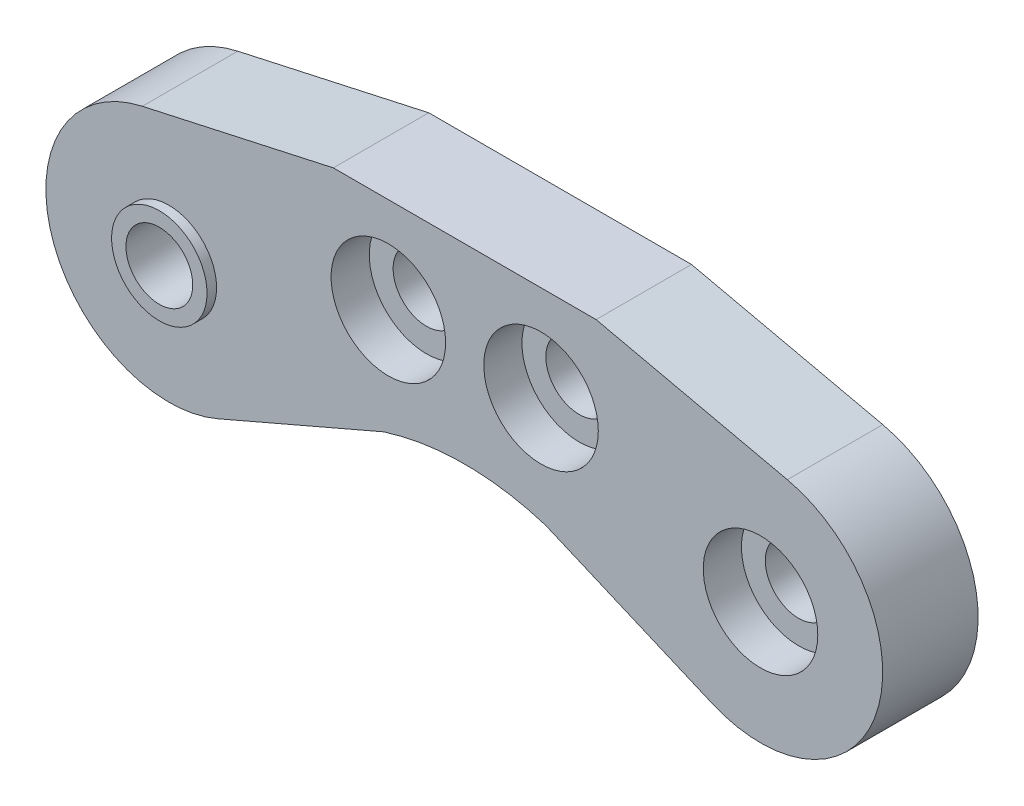
from build123d import *

# Parameters (mm, degrees)
BOSS_EXTRUDE1_DEPTH     = 5
CUT_EXTRUDE1_DEPTH      = 53.75142939
CUT_EXTRUDE1_DEPTH_BACK = 53.75142939
SKETCH2_R               = 1.75
BOSS_EXTRUDE2_START     = 0.5
SKETCH3_R               = 2.5
SKETCH3_R_2             = 1.75
BOSS_EXTRUDE2_DEPTH     = 0.5
SKETCH5_R               = 3
CUT_EXTRUDE2_DEPTH      = 2


with BuildPart() as part:
    # Sketch1 → Boss-Extrude1 (new body)
    with BuildSketch(Plane.XY):
        with BuildLine():
            Line((23.11684397, 8), (36.88315603, 8))
            Line((36.88315603, 8), (46.90520921, 5.744848006))
            ThreePointArc((46.90520921, 5.744848006), (51.591551748, -2.466147717), (42.989140572, -6.387981358))
            Line((42.989140572, -6.387981358), (34.244441462, -2.658908715))
            ThreePointArc((34.244441462, -2.658908715), (30, -2), (25.755558538, -2.658908715))
            Line((25.755558538, -2.658908715), (17.05409045, -6.415729603))
            ThreePointArc((17.05409045, -6.415729603), (8.36828995, -2.480244081), (13.111532947, 5.792169261))
            Line((13.111532947, 5.792169261), (23.11684397, 8))
        make_face()
    extrude(amount=BOSS_EXTRUDE1_DEPTH)

    # Sketch2 → Cut-Extrude1 (cut, two sides: drawn at the far end of the back side and taken through both)
    with BuildSketch(Plane.XY.offset(5).offset(-CUT_EXTRUDE1_DEPTH_BACK)):
        with Locations((45.5, -0.5)):
            Circle(SKETCH2_R)
        with Locations((14.5, -0.5)):
            Circle(SKETCH2_R)
        with Locations((26, 3)):
            Circle(SKETCH2_R)
        with Locations((34, 3)):
            Circle(SKETCH2_R)
    extrude(amount=CUT_EXTRUDE1_DEPTH + CUT_EXTRUDE1_DEPTH_BACK, mode=Mode.SUBTRACT)

    # Sketch3 → Boss-Extrude2 (add)
    with BuildSketch(Plane.XY.offset(5).offset(BOSS_EXTRUDE2_START)):
        with Locations((14.5, -0.5)):
            Circle(SKETCH3_R)
        with Locations((14.5, -0.5)):
            Circle(SKETCH3_R_2, mode=Mode.SUBTRACT)
    extrude(amount=-BOSS_EXTRUDE2_DEPTH)

    # Sketch5 → Cut-Extrude2 (cut)
    with BuildSketch(Plane.XY.offset(5)):
        with Locations((26, 3)):
            Circle(SKETCH5_R)
        with Locations((34, 3)):
            Circle(SKETCH5_R)
        with Locations((45.5, -0.5)):
            Circle(SKETCH5_R)
    extrude(amount=-CUT_EXTRUDE2_DEPTH, mode=Mode.SUBTRACT)


solid = part.part
